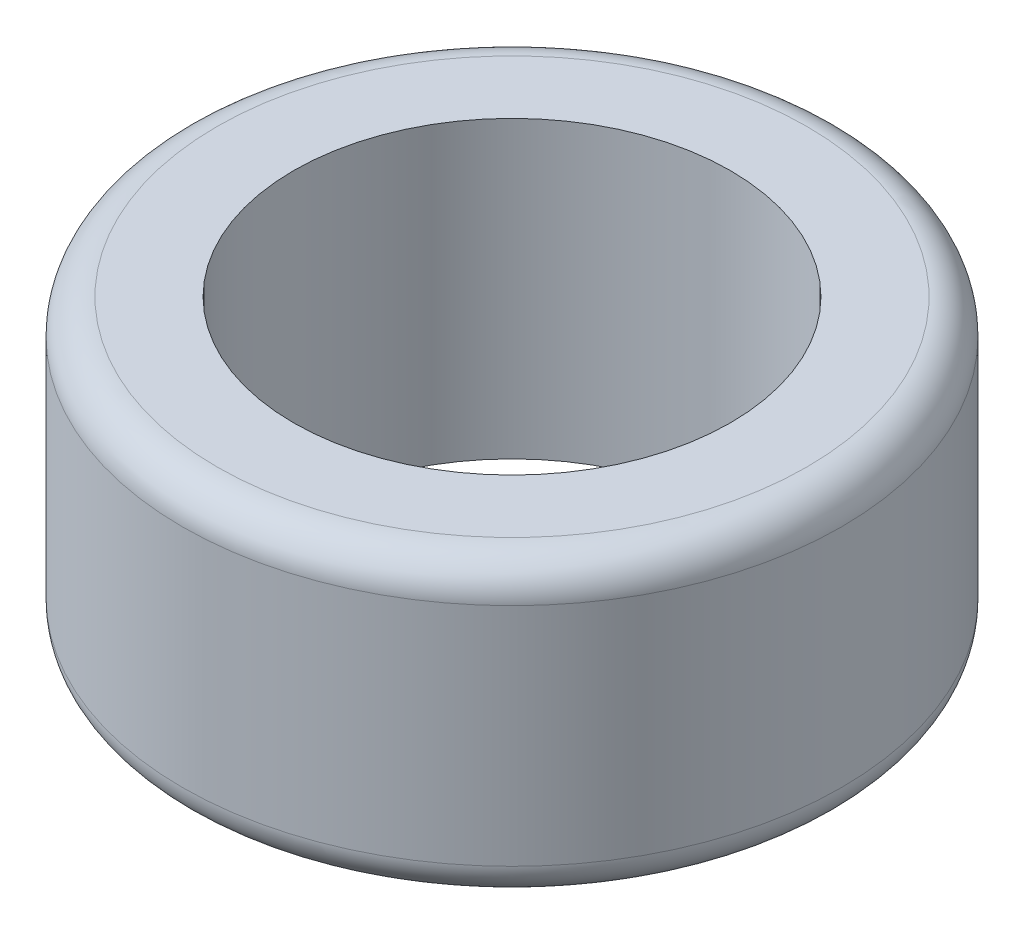
from build123d import *


with BuildPart() as part:
    # Sketch4 → Revolve1 (revolve)
    with BuildSketch(Plane.XY, mode=Mode.PRIVATE) as revolve1_sk:
        with BuildLine():
            Line((-152.4, 0), (-152.4, 205.74))
            Line((-152.4, 205.74), (-205.74, 205.74))
            ThreePointArc((-205.74, 205.74), (-222.80248663, 198.67248663), (-229.87, 181.61))
            Line((-229.87, 181.61), (-229.87, 24.13))
            ThreePointArc((-229.87, 24.13), (-222.80248663, 7.06751337), (-205.74, 0))
            Line((-205.74, 0), (-152.4, 0))
        make_face()
    revolve(revolve1_sk.sketch.rotate(Axis((0, 0, 0), (0, 1, 0)), 270), axis=Axis((0, 0, 0), (0, 1, 0)))


solid = part.part
